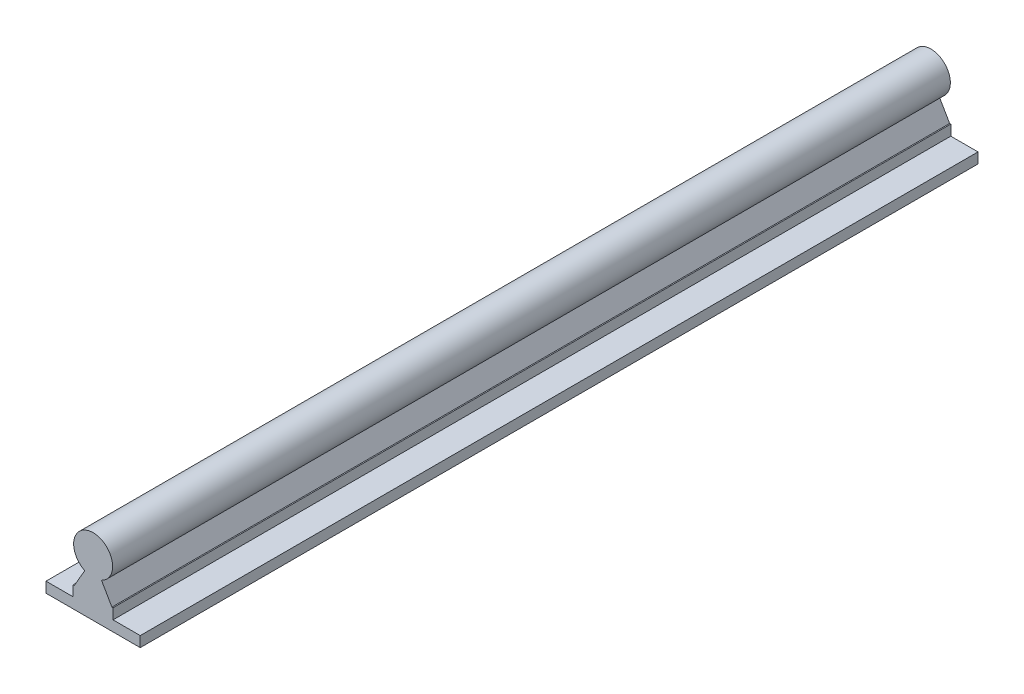
from build123d import *

# Parameters (mm, degrees)
EXTRUSION1_DEPTH = 400


with BuildPart() as part:
    # Sketch1 → Extrusion1 (new body)
    with BuildSketch(Plane.XY):
        with BuildLine():
            Line((-22.5, 0), (22.5, 0))
            Line((22.5, 0), (22.5, 5))
            Line((22.5, 5), (9.5, 5))
            Line((9.5, 5), (9.5, 10))
            Line((9.5, 10), (8.967618538, 10))
            Line((8.967618538, 10), (4, 18.604167701))
            ThreePointArc((4, 18.604167701), (0, 36.3), (-4, 18.604167701))
            Line((-4, 18.604167701), (-8.967618538, 10))
            Line((-8.967618538, 10), (-9.5, 10))
            Line((-9.5, 10), (-9.5, 5))
            Line((-9.5, 5), (-22.5, 5))
            Line((-22.5, 5), (-22.5, 0))
        make_face()
    extrude(amount=EXTRUSION1_DEPTH)


solid = part.part
